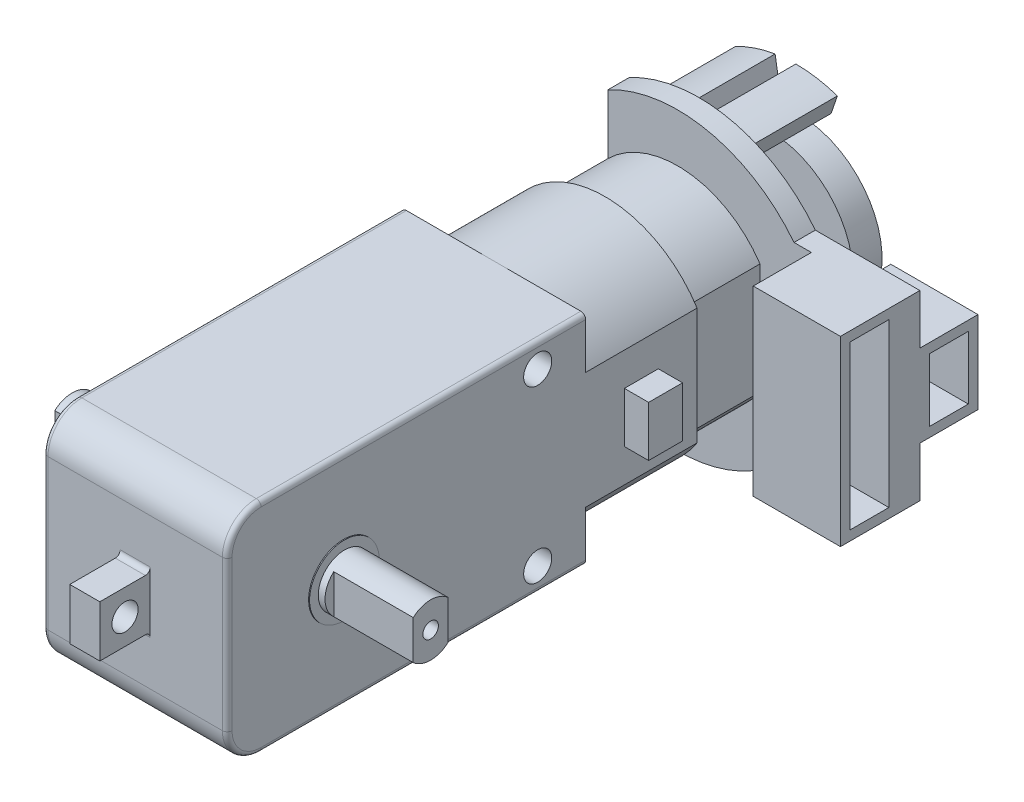
from build123d import *

# Parameters (mm, degrees)
SKETCH1_W                 = 37
SKETCH1_H                 = 22.5
BOSS_EXTRUDE1_DEPTH       = 19
SKETCH2_W                 = 3.1
SKETCH2_H                 = 5.3
BOSS_EXTRUDE2_DEPTH       = 5.2
SKETCH3_R                 = 1.35
CUT_EXTRUDE1_DEPTH        = 46.050027747
FILLET1_R                 = 3.5
SKETCH4_R                 = 3.6
BOSS_EXTRUDE3_DEPTH       = 0.1
BOSS_EXTRUDE4_START       = 0.1
SKETCH5_R                 = 3.6
BOSS_EXTRUDE4_DEPTH       = 0.1
SKETCH6_R                 = 2.7
BOSS_EXTRUDE5_DEPTH       = 8.9
BOSS_EXTRUDE6_START       = 8.9
SKETCH7_R                 = 2.7
BOSS_EXTRUDE6_DEPTH       = 8.9
FILLET2_R                 = 0.5
CUT_EXTRUDE2_START        = -8.2
CUT_EXTRUDE2_DEPTH        = 8.2
CUT_EXTRUDE3_DEPTH        = 8.2
M2X0_4_TAPPED_HOLE1_D     = 1.6
M2X0_4_TAPPED_HOLE1_DEPTH = 5.2
M2X0_4_TAPPED_HOLE1_TIP   = 0.480688495
M2X0_4_TAPPED_HOLE2_D     = 1.6
M2X0_4_TAPPED_HOLE2_DEPTH = 5.2
M2X0_4_TAPPED_HOLE2_TIP   = 0.480688495
SKETCH16_R                = 1.95
BOSS_EXTRUDE7_DEPTH       = 2
BOSS_EXTRUDE8_DEPTH       = 11.5
SKETCH18_W                = 3.5
SKETCH18_H                = 5.2
BOSS_EXTRUDE9_DEPTH       = 2.5
SKETCH19_W                = 3.5
SKETCH19_H                = 5.2
BOSS_EXTRUDE10_DEPTH      = 2.5
BOSS_EXTRUDE11_DEPTH      = 13.5
FILLET3_R                 = 1.7
BOSS_EXTRUDE12_DEPTH      = 2
SKETCH23_W                = 3.2
SKETCH23_H                = 6.5
SKETCH23_H_2              = 8.5
CUT_EXTRUDE4_DEPTH        = 6
SKETCH25_R                = 1.45
CUT_EXTRUDE5_DEPTH        = 52.878728782
FILLET4_R                 = 0.5
SKETCH26_R                = 1
BOSS_EXTRUDE13_DEPTH      = 4.5
SKETCH28_R                = 8.6
BOSS_EXTRUDE14_DEPTH      = 3
BOSS_EXTRUDE20_DEPTH      = 2.2
SKETCH30_W                = 9
SKETCH30_H                = 18.8
BOSS_EXTRUDE21_DEPTH      = 6
SKETCH31_W                = 9
SKETCH31_H                = 8.5
BOSS_EXTRUDE22_DEPTH      = 6
SKETCH32_W                = 4
SKETCH32_H                = 16.8
SKETCH32_H_2              = 6.5
CUT_EXTRUDE6_DEPTH        = 6
BOSS_EXTRUDE23_DEPTH      = 10


with BuildPart() as part:
    # Sketch1 → Boss-Extrude1 (new body)
    with BuildSketch(Plane(origin=(0, 0, 0), x_dir=(0, 0, -1), z_dir=(1, 0, 0))):
        with Locations((-18.5, 0)):
            Rectangle(SKETCH1_W, SKETCH1_H)
    extrude(amount=BOSS_EXTRUDE1_DEPTH)

    # Sketch2 → Boss-Extrude2 (add)
    with BuildSketch(Plane.XY.offset(37)):
        with Locations((9.5, 0)):
            Rectangle(SKETCH2_W, SKETCH2_H)
    extrude(amount=BOSS_EXTRUDE2_DEPTH)

    # Sketch3 → Cut-Extrude1 (cut, through all)
    with BuildSketch(Plane(origin=(11.05, 0, 0), x_dir=(0, 0, -1), z_dir=(1, 0, 0))):
        with Locations((-39.6, 0)):
            Circle(SKETCH3_R)
    extrude(amount=-CUT_EXTRUDE1_DEPTH, mode=Mode.SUBTRACT)

    # Fillet1
    fillet1_edges = [part.edges().sort_by_distance(p)[0] for p in [
        (9.5, -11.25, 37),
        (9.5, 11.25, 37),
    ]]
    fillet(fillet1_edges, radius=FILLET1_R)

    # Sketch4 → Boss-Extrude3 (add)
    with BuildSketch(Plane(origin=(19, 0, 0), x_dir=(0, 0, -1), z_dir=(1, 0, 0))):
        with Locations(Location((-25, 0, 0), (0, 0, 180))):
            Circle(SKETCH4_R)
    extrude(amount=BOSS_EXTRUDE3_DEPTH)

    # Sketch5 → Boss-Extrude4 (add)
    with BuildSketch(Plane.ZY.offset(BOSS_EXTRUDE4_START)):
        with Locations((25, 0)):
            Circle(SKETCH5_R)
    extrude(amount=-BOSS_EXTRUDE4_DEPTH)

    # Sketch6 → Boss-Extrude5 (add)
    with BuildSketch(Plane(origin=(19.1, 0, 0), x_dir=(0, 0, -1), z_dir=(1, 0, 0))):
        with Locations((-25, 0)):
            Circle(SKETCH6_R)
    extrude(amount=BOSS_EXTRUDE5_DEPTH)

    # Sketch7 → Boss-Extrude6 (add)
    with BuildSketch(Plane.ZY.offset(0.1).offset(BOSS_EXTRUDE6_START)):
        with Locations(Location((25, 0, 0), (0, 0, 180))):
            Circle(SKETCH7_R)
    extrude(amount=-BOSS_EXTRUDE6_DEPTH)

    # Fillet2
    fillet2_edges = [part.edges().sort_by_distance(p)[0] for p in [
        (9.5, 2.65, 37),
        (9.5, -2.65, 37),
    ]]
    fillet(fillet2_edges, radius=FILLET2_R)

    # Sketch8 → Cut-Extrude2 (cut)
    with BuildSketch(Plane(origin=(28, 0, 0), x_dir=(0, 0, -1), z_dir=(1, 0, 0)).offset(CUT_EXTRUDE2_START)):
        with BuildLine():
            Line((-26.8, -2.01246118), (-26.8, 2.01246118))
            ThreePointArc((-26.8, 2.01246118), (-27.7, 0), (-26.8, -2.01246118))
        make_face()
        with BuildLine():
            ThreePointArc((-22.3, 0), (-22.535248491, 1.102270384), (-23.2, 2.01246118))
            Line((-23.2, 2.01246118), (-23.2, -2.01246118))
            ThreePointArc((-23.2, -2.01246118), (-22.535248491, -1.102270384), (-22.3, 0))
        make_face()
    extrude(amount=CUT_EXTRUDE2_DEPTH, mode=Mode.SUBTRACT)

    # Sketch9 → Cut-Extrude3 (cut)
    with BuildSketch(Plane.ZY.offset(9)):
        with BuildLine():
            Line((23.2, -2.01246118), (23.2, 2.01246118))
            ThreePointArc((23.2, 2.01246118), (22.3, 0), (23.2, -2.01246118))
        make_face()
        with BuildLine():
            ThreePointArc((27.7, 0), (27.464751509, 1.102270384), (26.8, 2.01246118))
            Line((26.8, 2.01246118), (26.8, -2.01246118))
            ThreePointArc((26.8, -2.01246118), (27.464751509, -1.102270384), (27.7, 0))
        make_face()
    extrude(amount=-CUT_EXTRUDE3_DEPTH, mode=Mode.SUBTRACT)

    # M2x0.4 Tapped Hole1
    with Locations(Plane(origin=(28, 0, 0), x_dir=(0, 0, -1), z_dir=(1, 0, 0))):
        with Locations((-25, 0)):
            Hole(M2X0_4_TAPPED_HOLE1_D / 2, depth=M2X0_4_TAPPED_HOLE1_DEPTH)
            with Locations((0, 0, -(M2X0_4_TAPPED_HOLE1_DEPTH + M2X0_4_TAPPED_HOLE1_TIP / 2))):  # 118° drill point
                Cone(0, M2X0_4_TAPPED_HOLE1_D / 2, M2X0_4_TAPPED_HOLE1_TIP, mode=Mode.SUBTRACT)

    # M2x0.4 Tapped Hole2
    with Locations(Plane.ZY.offset(9)):
        with Locations((25, 0)):
            Hole(M2X0_4_TAPPED_HOLE2_D / 2, depth=M2X0_4_TAPPED_HOLE2_DEPTH)
            with Locations((0, 0, -(M2X0_4_TAPPED_HOLE2_DEPTH + M2X0_4_TAPPED_HOLE2_TIP / 2))):  # 118° drill point
                Cone(0, M2X0_4_TAPPED_HOLE2_D / 2, M2X0_4_TAPPED_HOLE2_TIP, mode=Mode.SUBTRACT)

    # Sketch16 → Boss-Extrude7 (add)
    with BuildSketch(Plane.ZY):
        with Locations((13.75, 0)):
            Circle(SKETCH16_R)
    extrude(amount=BOSS_EXTRUDE7_DEPTH)

    # Sketch17 → Boss-Extrude8 (add)
    with BuildSketch(Plane(origin=(0, 0, 0), x_dir=(-1, 0, 0), z_dir=(0, 0, -1))):
        with BuildLine():
            Line((-19, 6.025985397), (-19, -6.025985397))
            ThreePointArc((-19, -6.025985397), (-10.560588754, -11.199895156), (-1.3, -7.7021101))
            Line((-1.3, -7.7021101), (-1.3, 7.7021101))
            ThreePointArc((-1.3, 7.7021101), (-10.560588754, 11.199895156), (-19, 6.025985397))
        make_face()
    extrude(amount=BOSS_EXTRUDE8_DEPTH)

    # Sketch18 → Boss-Extrude9 (add)
    with BuildSketch(Plane(origin=(19, 0, 0), x_dir=(0, 0, -1), z_dir=(1, 0, 0))):
        with Locations((5.75, 0)):
            Rectangle(SKETCH18_W, SKETCH18_H)
    extrude(amount=BOSS_EXTRUDE9_DEPTH)

    # Sketch19 → Boss-Extrude10 (add)
    with BuildSketch(Plane.ZY.offset(-1.3)):
        with Locations((-5.75, 0)):
            Rectangle(SKETCH19_W, SKETCH19_H)
    extrude(amount=BOSS_EXTRUDE10_DEPTH)

    # Sketch20 → Boss-Extrude11 (add)
    with BuildSketch(Plane(origin=(0, 0, -11.5), x_dir=(-1, 0, 0), z_dir=(0, 0, -1))):
        with BuildLine():
            Line((-18, 5.728219619), (-18, -5.728219619))
            ThreePointArc((-18, -5.728219619), (-10.518083587, -10.199313987), (-2.3, -7.295375247))
            Line((-2.3, -7.295375247), (-2.3, 7.295375247))
            ThreePointArc((-2.3, 7.295375247), (-10.518083587, 10.199313987), (-18, 5.728219619))
        make_face()
    extrude(amount=BOSS_EXTRUDE11_DEPTH)

    # Fillet3
    fillet3_edges = [part.edges().sort_by_distance(p)[0] for p in [
        (10.518083587, 10.199313987, -25),
        (10.518083587, -10.199313987, -25),
    ]]
    fillet(fillet3_edges, radius=FILLET3_R)

    # Sketch21 → Boss-Extrude12 (add)
    with BuildSketch(Plane(origin=(0, 0, -25), x_dir=(-1, 0, 0), z_dir=(0, 0, -1))):
        with BuildLine():
            Line((-5.5, -3), (-5.5, 3))
            ThreePointArc((-5.5, 3), (-14.5, 0), (-5.5, -3))
        make_face()
    extrude(amount=BOSS_EXTRUDE12_DEPTH)

    # Sketch23 → Cut-Extrude4 (cut)
    with BuildSketch(Plane(origin=(0, 0, -25), x_dir=(-1, 0, 0), z_dir=(0, 0, -1))):
        with Locations((-9.5, 10.25)):
            Rectangle(SKETCH23_W, SKETCH23_H)
        with Locations((-9.5, -11.25)):
            Rectangle(SKETCH23_W, SKETCH23_H_2)
    extrude(amount=-CUT_EXTRUDE4_DEPTH, mode=Mode.SUBTRACT)

    # Sketch25 → Cut-Extrude5 (cut, through all)
    with BuildSketch(Plane(origin=(19, 0, 0), x_dir=(0, 0, -1), z_dir=(1, 0, 0))):
        with Locations((-4.95, 8.8)):
            Circle(SKETCH25_R)
        with Locations((-4.95, -8.8)):
            Circle(SKETCH25_R)
    extrude(amount=-CUT_EXTRUDE5_DEPTH, mode=Mode.SUBTRACT)

    # Fillet4
    fillet4_edges = [part.edges().sort_by_distance(p)[0] for p in [
        (0, -11.25, 16.75),
        (0, -10.224873734, 35.974873734),
        (0, 0, 37),
        (0, 10.224873734, 35.974873734),
        (19, -11.25, 16.75),
        (19, -10.224873734, 35.974873734),
        (19, 0, 37),
        (19, 10.224873734, 35.974873734),
        (0, 11.25, 16.75),
        (19, 11.25, 16.75),
    ]]
    fillet(fillet4_edges, radius=FILLET4_R)

    # Sketch26 → Boss-Extrude13 (add)
    with BuildSketch(Plane(origin=(0, 0, -27), x_dir=(-1, 0, 0), z_dir=(0, 0, -1))):
        with Locations((-9.5, 0)):
            Circle(SKETCH26_R)
    extrude(amount=BOSS_EXTRUDE13_DEPTH)

    # Sketch28 → Boss-Extrude14 (add)
    with BuildSketch(Plane(origin=(0, 0, -31.5), x_dir=(-1, 0, 0), z_dir=(0, 0, -1))):
        with Locations((-9.5, 0)):
            Circle(SKETCH28_R)
    extrude(amount=-BOSS_EXTRUDE14_DEPTH)

    # Sketch29 → Boss-Extrude20 (add)
    with BuildSketch(Plane(origin=(0, 0, -19), x_dir=(-1, 0, 0), z_dir=(0, 0, -1))):
        with BuildLine():
            Line((-18, -5.728219619), (-18, 5.728219619))
            ThreePointArc((-18, 5.728219619), (-15.00763058, 8.644565078), (-11.1, 10.124351831))
            ThreePointArc((-11.1, 10.124351831), (-9.5, 10.25), (-7.9, 10.124351831))
            ThreePointArc((-7.9, 10.124351831), (-4.878227923, 9.148864567), (-2.3, 7.295375247))
            Line((-2.3, 7.295375247), (-2.3, 13.443306885))
            ThreePointArc((-2.3, 13.443306885), (-12.64123277, 14.922974123), (-21.508434536, 9.4))
            Line((-21.508434536, 9.4), (-21.508434536, -9.4))
            ThreePointArc((-21.508434536, -9.4), (-12.64123277, -14.922974123), (-2.3, -13.443306885))
            Line((-2.3, -13.443306885), (-2.3, -7.295375247))
            ThreePointArc((-2.3, -7.295375247), (-4.878227923, -9.148864567), (-7.9, -10.124351831))
            ThreePointArc((-7.9, -10.124351831), (-9.5, -10.25), (-11.1, -10.124351831))
            ThreePointArc((-11.1, -10.124351831), (-15.00763058, -8.644565078), (-18, -5.728219619))
        make_face()
        with BuildLine():
            Line((-11.1, -9.26165505), (-11.1, -10.124351831))
            ThreePointArc((-11.1, -10.124351831), (-9.5, -10.25), (-7.9, -10.124351831))
            Line((-7.9, -10.124351831), (-7.9, -9.26165505))
            ThreePointArc((-7.9, -9.26165505), (-9.5, -8.799370558), (-11.1, -9.26165505))
        make_face()
        with BuildLine():
            ThreePointArc((-7.9, 10.124351831), (-9.5, 10.25), (-11.1, 10.124351831))
            Line((-11.1, 10.124351831), (-11.1, 9.26165505))
            ThreePointArc((-11.1, 9.26165505), (-9.5, 8.799370558), (-7.9, 9.26165505))
            Line((-7.9, 9.26165505), (-7.9, 10.124351831))
        make_face()
        with BuildLine():
            ThreePointArc((-23, 7.09313048), (-22.30626682, 8.280219208), (-21.508434536, 9.4))
            Line((-21.508434536, 9.4), (-32.3, 9.4))
            Line((-32.3, 9.4), (-32.3, -9.4))
            Line((-32.3, -9.4), (-21.508434536, -9.4))
            ThreePointArc((-21.508434536, -9.4), (-22.30626682, -8.280219208), (-23, -7.09313048))
            Line((-23, -7.09313048), (-23, 7.09313048))
        make_face()
        with BuildLine():
            Line((-21.508434536, -9.4), (-21.508434536, 9.4))
            ThreePointArc((-21.508434536, 9.4), (-22.30626682, 8.280219208), (-23, 7.09313048))
            Line((-23, 7.09313048), (-23, -7.09313048))
            ThreePointArc((-23, -7.09313048), (-22.30626682, -8.280219208), (-21.508434536, -9.4))
        make_face()
    extrude(amount=BOSS_EXTRUDE20_DEPTH)

    # Sketch30 → Boss-Extrude21 (add)
    with BuildSketch(Plane.XY.offset(-19)):
        with Locations((27.8, 0)):
            Rectangle(SKETCH30_W, SKETCH30_H)
    extrude(amount=BOSS_EXTRUDE21_DEPTH)

    # Sketch31 → Boss-Extrude22 (add)
    with BuildSketch(Plane(origin=(0, 0, -21.2), x_dir=(-1, 0, 0), z_dir=(0, 0, -1))):
        with Locations((-27.8, 0)):
            Rectangle(SKETCH31_W, SKETCH31_H)
    extrude(amount=BOSS_EXTRUDE22_DEPTH)

    # Sketch32 → Cut-Extrude6 (cut)
    with BuildSketch(Plane(origin=(32.3, 0, 0), x_dir=(0, 0, -1), z_dir=(1, 0, 0))):
        with Locations((16, 0)):
            Rectangle(SKETCH32_W, SKETCH32_H)
        with Locations((24.2, 0)):
            Rectangle(SKETCH32_W, SKETCH32_H_2)
    extrude(amount=-CUT_EXTRUDE6_DEPTH, mode=Mode.SUBTRACT)

    # Sketch33 → Boss-Extrude23 (add)
    with BuildSketch(Plane(origin=(0, 0, -21.2), x_dir=(-1, 0, 0), z_dir=(0, 0, -1))):
        with BuildLine():
            Line((-9.5, 11.25), (-9.5, 13.25))
            ThreePointArc((-9.5, 13.25), (-11.672131148, 13.070743907), (-13.785489806, 12.537825853))
            Line((-13.785489806, 12.537825853), (-13.13862342, 10.645323838))
            ThreePointArc((-13.13862342, 10.645323838), (-11.344262295, 11.09780143), (-9.5, 11.25))
        make_face()
        with BuildLine():
            Line((-4.18852459, 9.917193604), (-3.244262295, 11.680250244))
            ThreePointArc((-3.244262295, 11.680250244), (-5.243689802, 12.547761693), (-7.358282522, 13.075761785))
            Line((-7.358282522, 13.075761785), (-7.681560632, 11.102061893))
            ThreePointArc((-7.681560632, 11.102061893), (-5.886151719, 10.653759928), (-4.18852459, 9.917193604))
        make_face()
        with BuildLine():
            Line((-9.5, -13.25), (-9.5, -11.25))
            ThreePointArc((-9.5, -11.25), (-11.344262295, -11.09780143), (-13.13862342, -10.645323838))
            Line((-13.13862342, -10.645323838), (-13.785489806, -12.537825853))
            ThreePointArc((-13.785489806, -12.537825853), (-11.672131148, -13.070743907), (-9.5, -13.25))
        make_face()
        with BuildLine():
            ThreePointArc((-7.358282522, -13.075761785), (-5.243689802, -12.547761693), (-3.244262295, -11.680250244))
            Line((-3.244262295, -11.680250244), (-4.18852459, -9.917193604))
            ThreePointArc((-4.18852459, -9.917193604), (-5.886151719, -10.653759928), (-7.681560632, -11.102061893))
            Line((-7.681560632, -11.102061893), (-7.358282522, -13.075761785))
        make_face()
    extrude(amount=BOSS_EXTRUDE23_DEPTH)


solid = part.part
